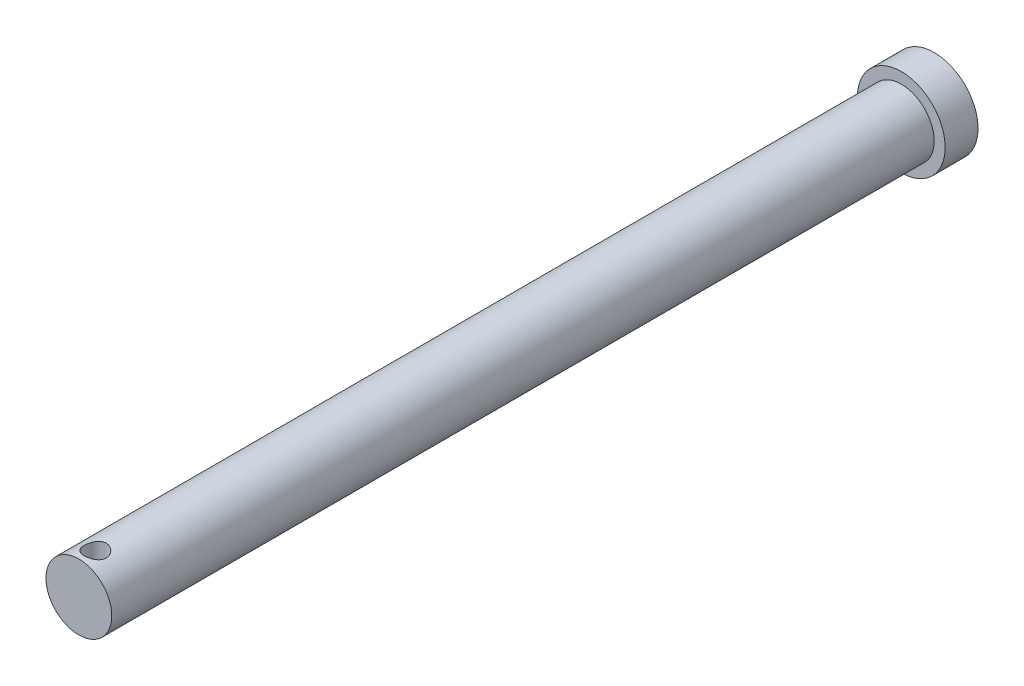
from build123d import *

# Parameters (mm, degrees)
SKETCH1_R               = 3
BOSS_EXTRUDE1_DEPTH     = 37.5
SKETCH2_R               = 4
BOSS_EXTRUDE2_DEPTH     = 3
CUT_EXTRUDE1_DEPTH      = 41.893153461
CUT_EXTRUDE1_DEPTH_BACK = 41.893153461
SKETCH3_R               = 1


with BuildPart() as part:
    # Sketch1 → Boss-Extrude1 (new, symmetric)
    with BuildSketch(Plane.XY):
        Circle(SKETCH1_R)
    extrude(amount=BOSS_EXTRUDE1_DEPTH, both=True)

    # Sketch2 → Boss-Extrude2 (add)
    with BuildSketch(Plane(origin=(0, 0, -37.5), x_dir=(-1, 0, 0), z_dir=(0, 0, -1))):
        Circle(SKETCH2_R)
    extrude(amount=BOSS_EXTRUDE2_DEPTH)

    # Sketch3 → Cut-Extrude1 (cut, two sides: drawn at the far end of the back side and taken through both)
    with BuildSketch(Plane(origin=(0, 0, 0), x_dir=(1, 0, 0), z_dir=(0, 1, 0)).offset(-CUT_EXTRUDE1_DEPTH_BACK)):
        with Locations(Location((0, -36, 0), (0, 0, 270))):
            Circle(SKETCH3_R)
    extrude(amount=CUT_EXTRUDE1_DEPTH + CUT_EXTRUDE1_DEPTH_BACK, mode=Mode.SUBTRACT)


solid = part.part
